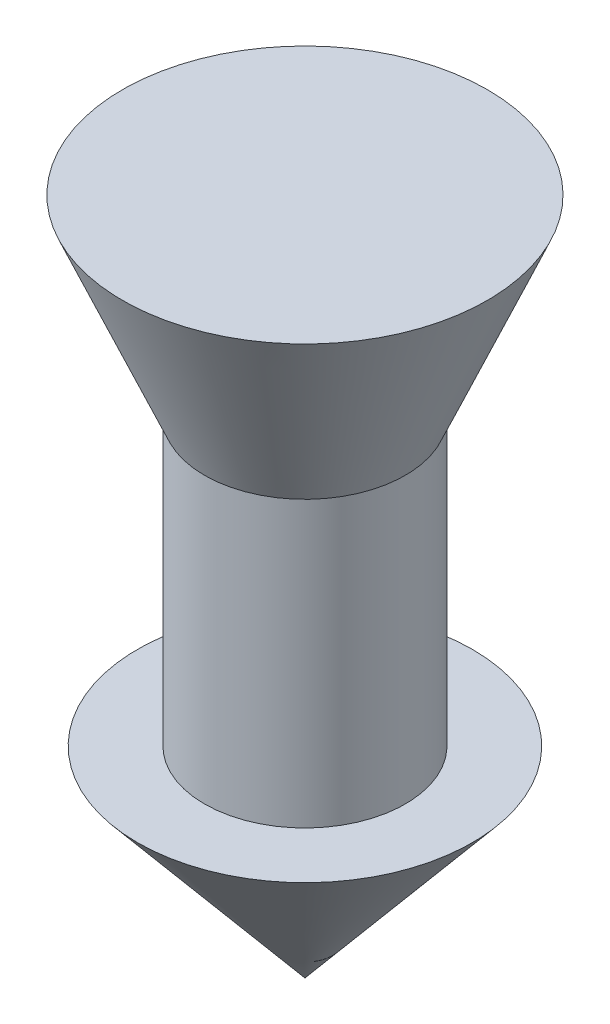
from build123d import *


with BuildPart() as part:
    # Sketch1 → Revolve1 (revolve)
    with BuildSketch(Plane(origin=(0, 0, 0), x_dir=(0, 0, -1), z_dir=(1, 0, 0))):
        Polygon((0, 0), (10, 12), (6, 12), (6, 29), (10.9, 40.5), (0, 40.5), align=None)
    revolve(axis=Axis((0, 0, 0), (0, 1, 0)))


solid = part.part
